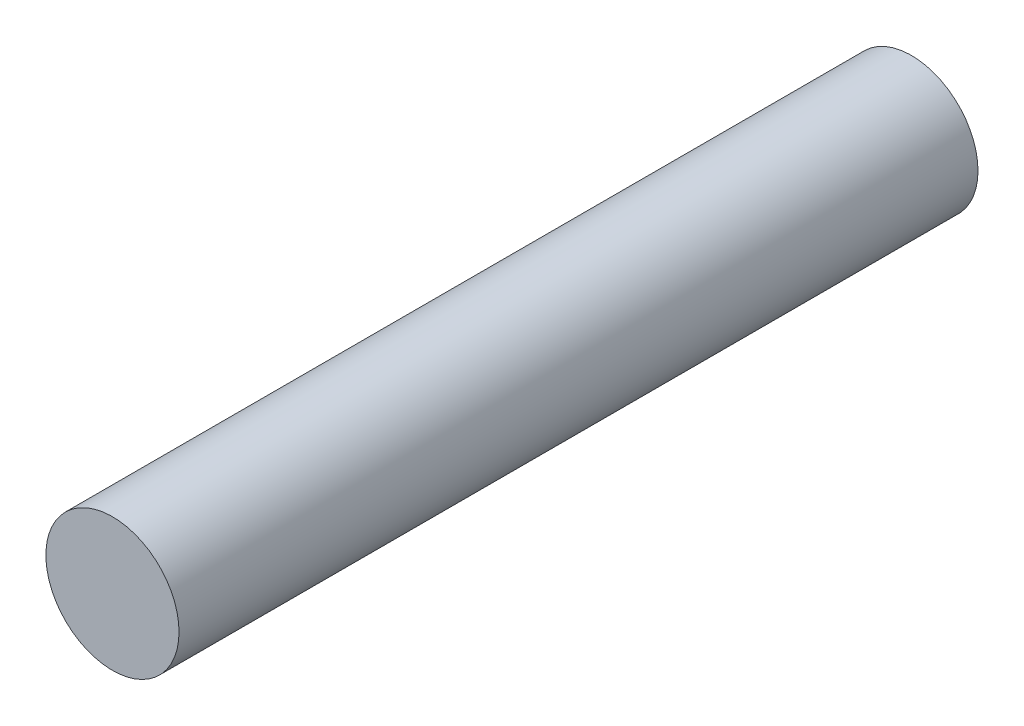
from build123d import *

# Parameters (mm, degrees)
SKETCH1_R           = 12.5
BOSS_EXTRUDE1_DEPTH = 150


with BuildPart() as part:
    # Sketch1 → Boss-Extrude1 (new body)
    with BuildSketch(Plane.XY):
        Circle(SKETCH1_R)
    extrude(amount=BOSS_EXTRUDE1_DEPTH)


solid = part.part
